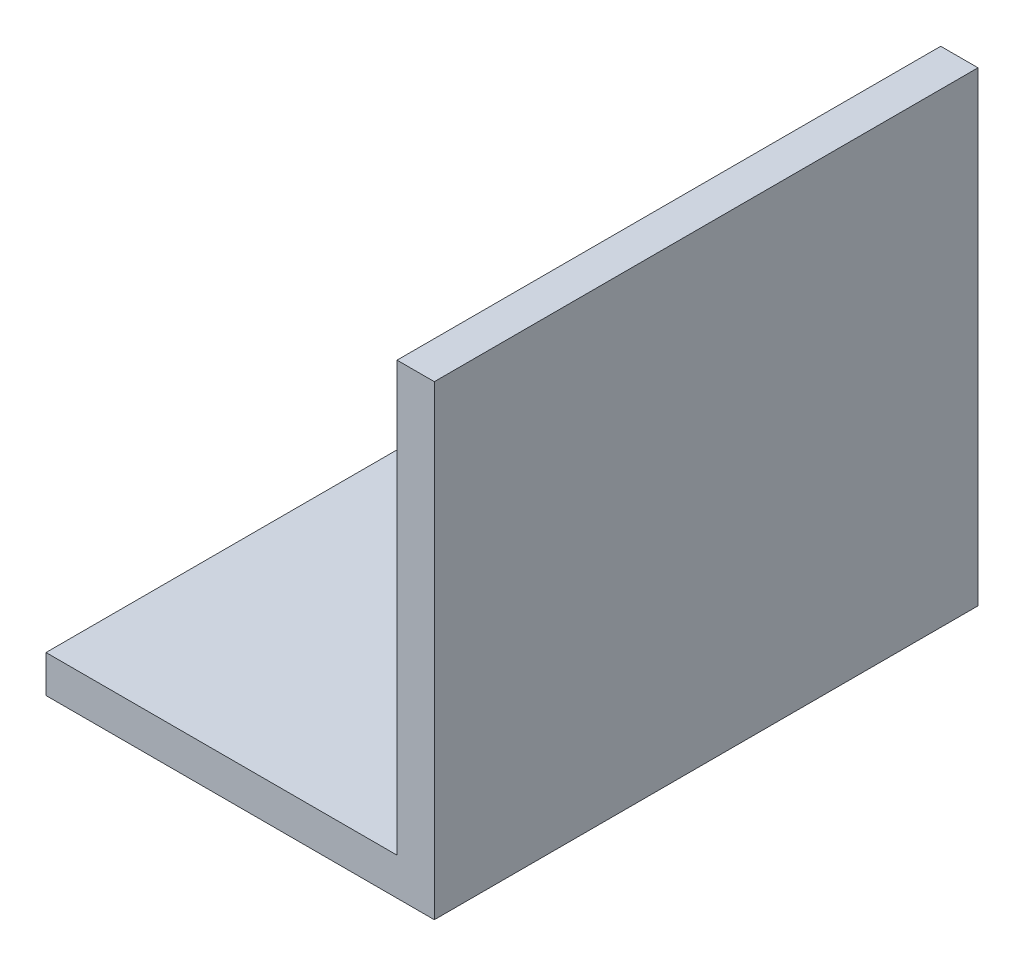
from build123d import *

# Parameters (mm, degrees)
BOSS_EXTRUDE1_DEPTH       = 11.1125
F_8_CLEARANCE_HOLE1_D     = 4.4958
F_8_CLEARANCE_HOLE1_DEPTH = 31.75
F_8_CLEARANCE_HOLE1_TIP   = 1.350674586


with BuildPart() as part:
    # Sketch1 → Boss-Extrude1 (new, symmetric)
    with BuildSketch(Plane.XY):
        Polygon((-14.351, 0), (0, 0), (0, 17.526), (1.524, 17.526), (1.524, -1.524), (-14.351, -1.524), align=None)
    extrude(amount=BOSS_EXTRUDE1_DEPTH, both=True)

    # #8 Clearance Hole1
    with Locations(Plane(origin=(0, 0, 0), x_dir=(1, 0, 0), z_dir=(0, 1, 0))):
        with Locations((-7.1755, 0)):
            Hole(F_8_CLEARANCE_HOLE1_D / 2, depth=F_8_CLEARANCE_HOLE1_DEPTH)
            with Locations((0, 0, -(F_8_CLEARANCE_HOLE1_DEPTH + F_8_CLEARANCE_HOLE1_TIP / 2))):  # 118° drill point
                Cone(0, F_8_CLEARANCE_HOLE1_D / 2, F_8_CLEARANCE_HOLE1_TIP, mode=Mode.SUBTRACT)


solid = part.part
